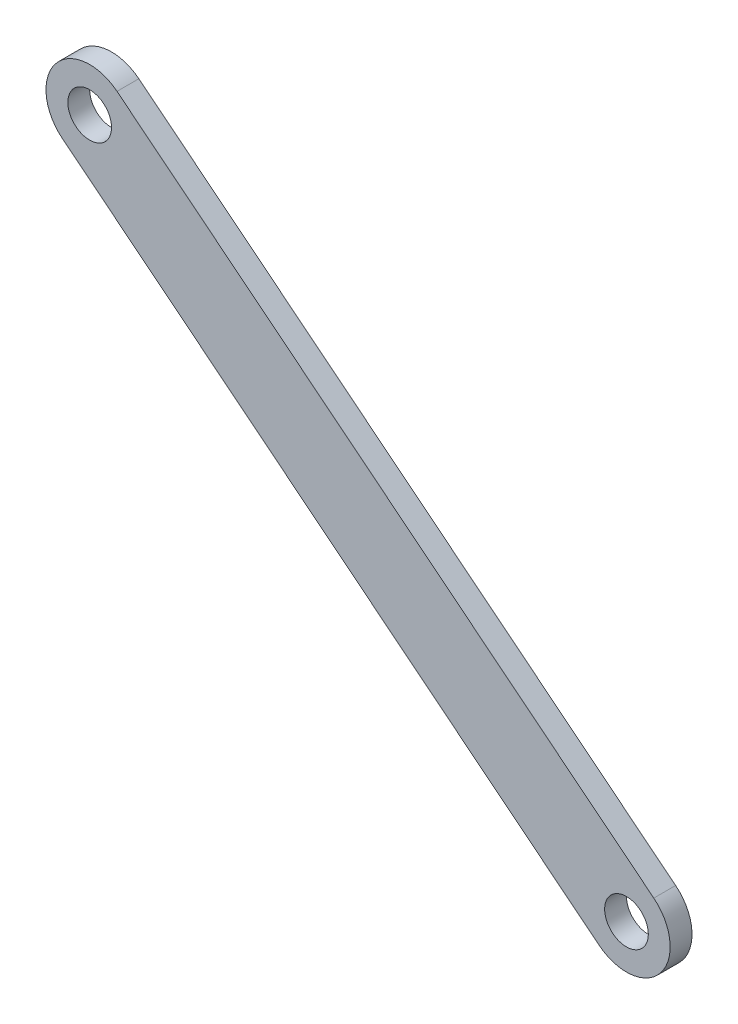
from build123d import *

# Parameters (mm, degrees)
SKETCH1_R           = 1.5875
BOSS_EXTRUDE1_DEPTH = 1.5875


with BuildPart() as part:
    # Sketch1 → Boss-Extrude1 (new body)
    with BuildSketch(Plane.XY):
        with BuildLine():
            Line((-22.027756909, 33.749456934), (16.985778188, 2.477359479))
            ThreePointArc((16.985778188, 2.477359479), (17.477359479, -1.985778188), (13.014221812, -2.477359479))
            Line((13.014221812, -2.477359479), (-25.999313286, 28.794737976))
            ThreePointArc((-25.999313286, 28.794737976), (-26.490894576, 33.257875643), (-22.027756909, 33.749456934))
        make_face()
        with Locations((-24.013535097, 31.272097455)):
            Circle(SKETCH1_R, mode=Mode.SUBTRACT)
        with Locations((15, 0)):
            Circle(SKETCH1_R, mode=Mode.SUBTRACT)
    extrude(amount=BOSS_EXTRUDE1_DEPTH)


solid = part.part
